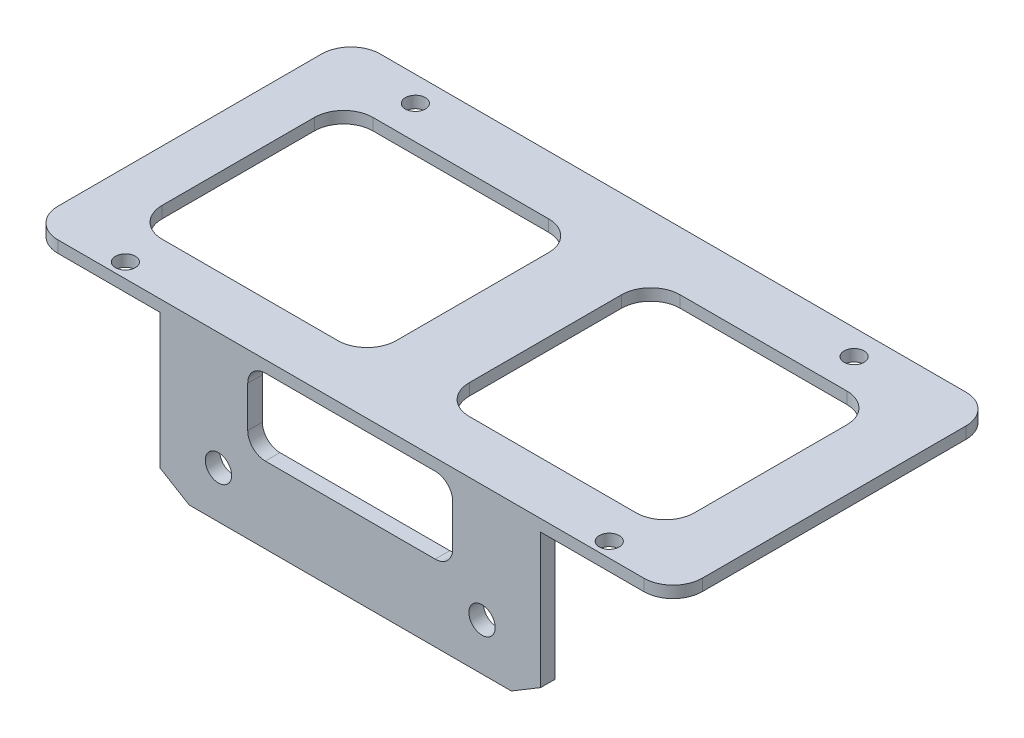
from build123d import *

# Parameters (mm, degrees)
SKETCH_1_R          = 1.7
EXTRUDE_2_DEPTH     = 2
SKETCH_2_W          = 65
SKETCH_2_H          = 2.5
EXTRUDE_3_DEPTH     = 30
SKETCH_3_R          = 2.25
CUT_EXTRUDE_1_DEPTH = 2.5


with BuildPart() as part:
    # 草图1 → 凸台-拉伸2 (new body)
    with BuildSketch(Plane(origin=(0, 0, 0), x_dir=(1, 0, 0), z_dir=(0, 1, 0))):
        with BuildLine():
            Line((5, 0), (105, 0))
            ThreePointArc((105, 0), (108.535533906, 1.464466094), (110, 5))
            Line((110, 5), (110, 50))
            ThreePointArc((110, 50), (108.535533906, 53.535533906), (105, 55))
            Line((105, 55), (5, 55))
            ThreePointArc((5, 55), (1.464466094, 53.535533906), (0, 50))
            Line((0, 50), (0, 5))
            ThreePointArc((0, 5), (1.464466094, 1.464466094), (5, 0))
        make_face()
        with Locations(Location((14, 2.5, 0), (0, 0, 270))):
            Circle(SKETCH_1_R, mode=Mode.SUBTRACT)
        with Locations(Location((15.3, 50.7, 0), (0, 0, 270))):
            Circle(SKETCH_1_R, mode=Mode.SUBTRACT)
        with Locations(Location((90.2, 50.7, 0), (0, 0, 270))):
            Circle(SKETCH_1_R, mode=Mode.SUBTRACT)
        with Locations(Location((96.6, 2.5, 0), (0, 0, 270))):
            Circle(SKETCH_1_R, mode=Mode.SUBTRACT)
        with BuildLine():
            Line((13.766884745, 45), (43.750231267, 45))
            ThreePointArc((43.750231267, 45), (47.285765173, 43.535533906), (48.750231267, 40))
            Line((48.750231267, 40), (48.750231267, 14))
            ThreePointArc((48.750231267, 14), (47.285765173, 10.464466094), (43.750231267, 9))
            Line((43.750231267, 9), (13.766884745, 9))
            ThreePointArc((13.766884745, 9), (10.231350839, 10.464466094), (8.766884745, 14))
            Line((8.766884745, 14), (8.766884745, 40))
            ThreePointArc((8.766884745, 40), (10.231350839, 43.535533906), (13.766884745, 45))
        make_face(mode=Mode.SUBTRACT)
        with BuildLine():
            Line((66.201792467, 45), (94.663281509, 45))
            ThreePointArc((94.663281509, 45), (98.198815415, 43.535533906), (99.663281509, 40))
            Line((99.663281509, 40), (99.663281509, 14))
            ThreePointArc((99.663281509, 14), (98.198815415, 10.464466094), (94.663281509, 9))
            Line((94.663281509, 9), (66.201792467, 9))
            ThreePointArc((66.201792467, 9), (62.666258562, 10.464466094), (61.201792467, 14))
            Line((61.201792467, 14), (61.201792467, 40))
            ThreePointArc((61.201792467, 40), (62.666258562, 43.535533906), (66.201792467, 45))
        make_face(mode=Mode.SUBTRACT)
    extrude(amount=EXTRUDE_2_DEPTH)

    # 草图2 → 凸台-拉伸3 (add)
    with BuildSketch(Plane.XZ):
        with Locations((54.883282113, -1.25)):
            Rectangle(SKETCH_2_W, SKETCH_2_H)
    extrude(amount=EXTRUDE_3_DEPTH)

    # 草图3 → 切除-拉伸1 (cut)
    with BuildSketch(Plane.XY):
        with Locations((77.383282113, -18)):
            Circle(SKETCH_3_R)
        with Locations((32.383282113, -18)):
            Circle(SKETCH_3_R)
        Polygon((87.383282113, -30), (87.383282113, -23), (82.383282113, -26), (27.383282113, -26), (22.383282113, -23), (22.383282113, -30), align=None)
        with BuildLine():
            Line((69.383282113, -13), (40.383282113, -13))
            ThreePointArc((40.383282113, -13), (38.26196177, -12.121320344), (37.383282113, -10))
            Line((37.383282113, -10), (37.383282113, -3))
            ThreePointArc((37.383282113, -3), (38.26196177, -0.878679656), (40.383282113, 0))
            Line((40.383282113, 0), (69.383282113, 0))
            ThreePointArc((69.383282113, 0), (71.504602457, -0.878679656), (72.383282113, -3))
            Line((72.383282113, -3), (72.383282113, -10))
            ThreePointArc((72.383282113, -10), (71.504602457, -12.121320344), (69.383282113, -13))
        make_face()
    extrude(amount=-CUT_EXTRUDE_1_DEPTH, mode=Mode.SUBTRACT)


solid = part.part
